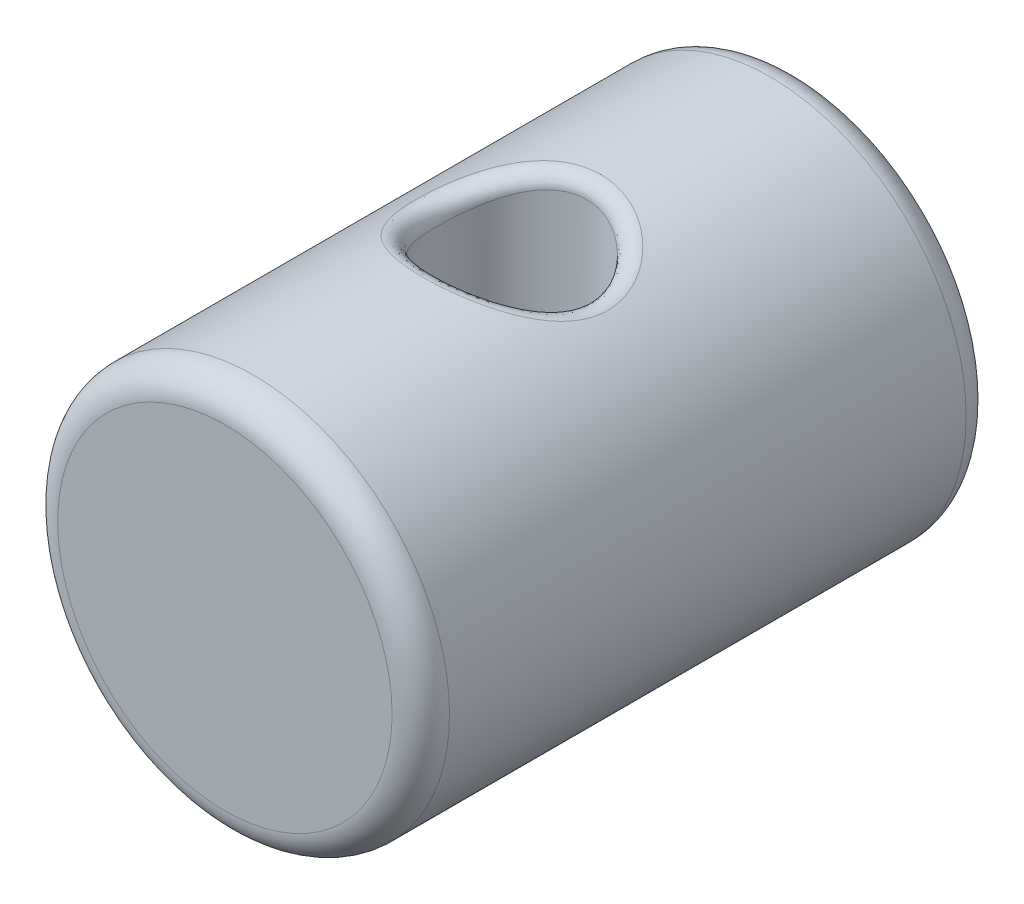
from build123d import *

# Parameters (mm, degrees)
BOSS_EXTRUDE1_DEPTH      = 10
BOSS_EXTRUDE1_DEPTH_BACK = 10
SKETCH1_R                = 6.825
CUT_EXTRUDE1_DEPTH       = 14.898246292
CUT_EXTRUDE1_DEPTH_BACK  = 14.898246292
SKETCH2_R                = 2.6
FILLET1_R                = 1
FILLET2_R                = 0.5


with BuildPart() as part:
    # Sketch1 → Boss-Extrude1 (new, two sides: drawn at the far end of the back side and taken through both)
    with BuildSketch(Plane.XY.offset(-BOSS_EXTRUDE1_DEPTH_BACK)):
        Circle(SKETCH1_R)
    extrude(amount=BOSS_EXTRUDE1_DEPTH + BOSS_EXTRUDE1_DEPTH_BACK)

    # Sketch2 → Cut-Extrude1 (cut, two sides: drawn at the far end of the back side and taken through both)
    with BuildSketch(Plane(origin=(0, 0, 0), x_dir=(1, 0, 0), z_dir=(0, 1, 0)).offset(-CUT_EXTRUDE1_DEPTH_BACK)):
        Circle(SKETCH2_R)
    extrude(amount=CUT_EXTRUDE1_DEPTH + CUT_EXTRUDE1_DEPTH_BACK, mode=Mode.SUBTRACT)

    # Fillet1
    fillet1_edges = [part.edges().sort_by_distance(p)[0] for p in [
        (-6.825, 0, -10),
        (-6.825, 0, 10),
    ]]
    fillet(fillet1_edges, radius=FILLET1_R)

    # Fillet2
    fillet2_edges = [part.edges().sort_by_distance(p)[0] for p in [
        (1e-09, -6.825, -2.600000001),
        (1e-09, 6.825, -2.600000001),
    ]]
    fillet(fillet2_edges, radius=FILLET2_R)


solid = part.part
